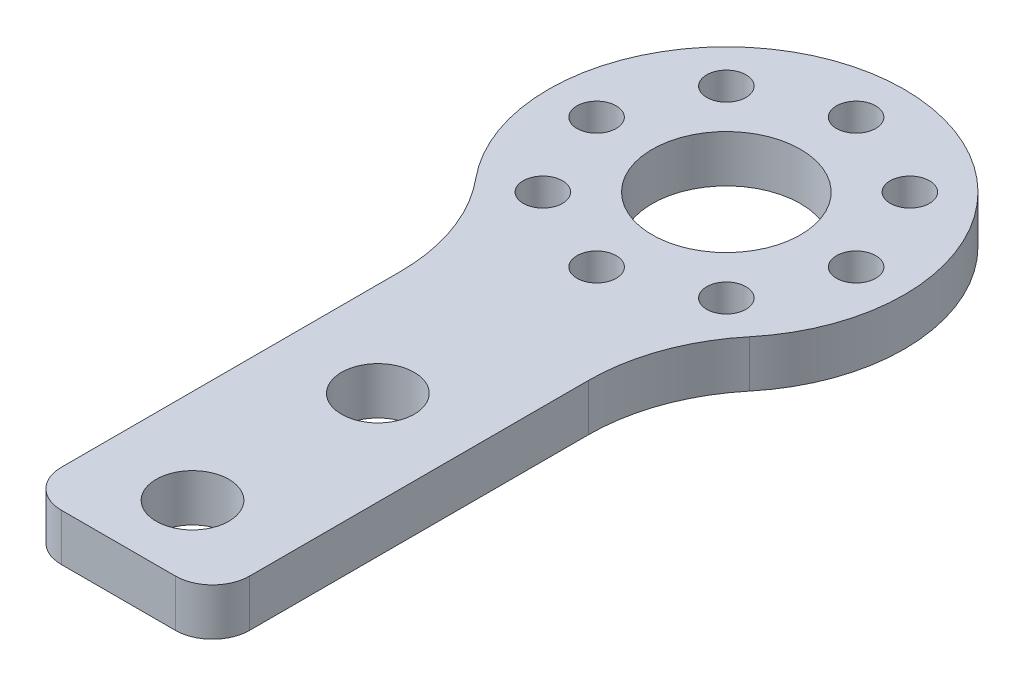
from build123d import *

# Parameters (mm, degrees)
BOSS_EXTRUDE1_DEPTH     = 6.35
M5_CLEARANCE_HOLE1_D    = 5.3
SKETCH5_R               = 10
CUT_EXTRUDE1_DEPTH      = 86.675682081
FILLET1_R               = 25
FILLET2_R               = 5
F_3_8_CLEARANCE_HOLE1_D = 9.8044


with BuildPart() as part:
    # Sketch1 → Boss-Extrude1 (new body)
    with BuildSketch(Plane(origin=(0, 0, 0), x_dir=(1, 0, 0), z_dir=(0, 1, 0))):
        with BuildLine():
            Line((-12.7, -82), (12.7, -82))
            Line((12.7, -82), (12.7, -20.364429774))
            ThreePointArc((12.7, -20.364429774), (0, 24), (-12.7, -20.364429774))
            Line((-12.7, -20.364429774), (-12.7, -82))
        make_face()
    extrude(amount=BOSS_EXTRUDE1_DEPTH)

    # M5 Clearance Hole1 (through all)
    with Locations(Plane(origin=(0, 0, 0), x_dir=(-1, 0, 0), z_dir=(0, -1, 0))):
        with Locations((0, 17.5), (12.374368671, 12.374368671), (17.5, 0), (12.374368671, -12.374368671), (0, -17.5), (-12.374368671, -12.374368671), (-17.5, 0), (-12.374368671, 12.374368671)):
            Hole(M5_CLEARANCE_HOLE1_D / 2)

    # Sketch5 → Cut-Extrude1 (cut, through all)
    with BuildSketch(Plane.XZ):
        Circle(SKETCH5_R)
    extrude(amount=-CUT_EXTRUDE1_DEPTH, mode=Mode.SUBTRACT)

    # Fillet1
    fillet1_edges = [part.edges().sort_by_distance(p)[0] for p in [
        (-12.7, 3.175, 20.364429774),
        (12.7, 3.175, 20.364429774),
    ]]
    fillet(fillet1_edges, radius=FILLET1_R)

    # Fillet2
    fillet2_edges = [part.edges().sort_by_distance(p)[0] for p in [
        (12.7, 3.175, 82),
        (-12.7, 3.175, 82),
    ]]
    fillet(fillet2_edges, radius=FILLET2_R)

    # 3/8 Clearance Hole1 (through all)
    with Locations(Plane(origin=(0, 0, 0), x_dir=(-1, 0, 0), z_dir=(0, -1, 0))):
        with Locations((0, -47), (0, -72)):
            Hole(F_3_8_CLEARANCE_HOLE1_D / 2)


solid = part.part
